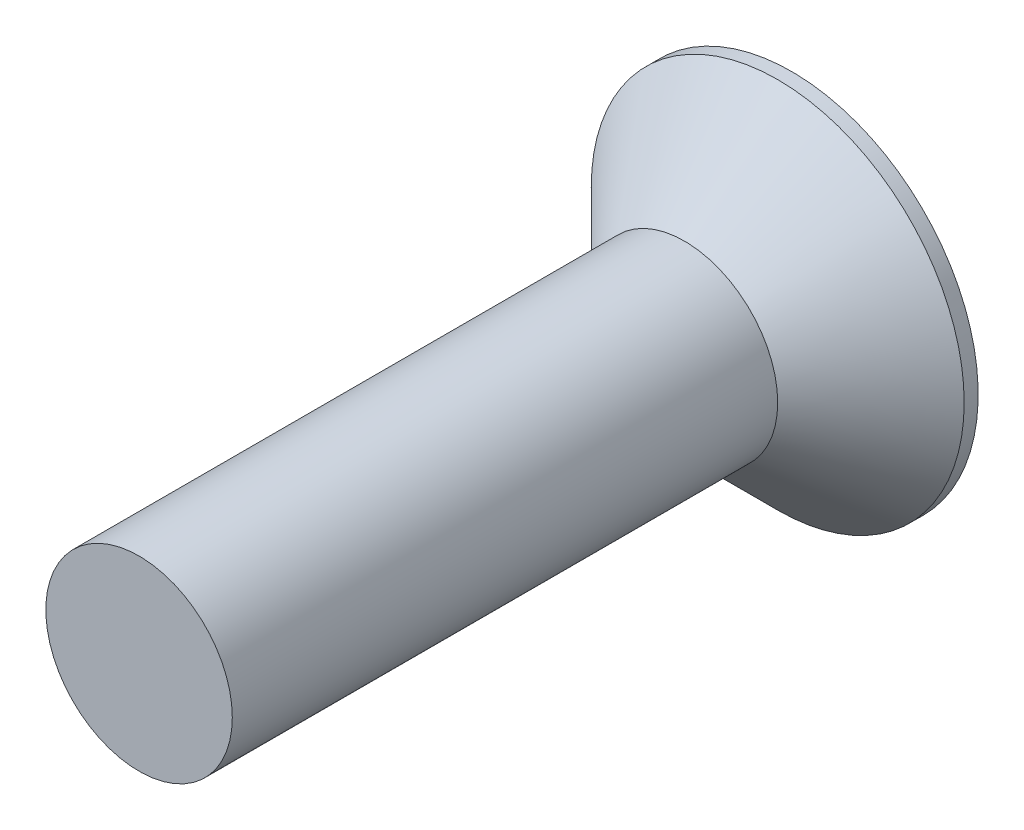
from build123d import *

# Parameters (mm, degrees)
SKETCH1_R          = 2
EXTRUDE1_DEPTH     = 14
SKETCH6_R          = 4
EXTRUDE2_DEPTH     = 2.3
CUT_EXTRUDE1_DEPTH = 1.875


with BuildPart() as part:
    # Sketch1 → Extrude1 (new body)
    with BuildSketch(Plane.XY):
        Circle(SKETCH1_R)
    extrude(amount=-EXTRUDE1_DEPTH)

    # Sketch6 → Extrude2 (add)
    with BuildSketch(Plane(origin=(0, 0, -14), x_dir=(-1, 0, 0), z_dir=(0, 0, -1))):
        Circle(SKETCH6_R)
    extrude(amount=-EXTRUDE2_DEPTH)

    # Sketch10 → Cut-Revolve2 (revolve, cut)
    with BuildSketch(Plane(origin=(0, 0, 0), x_dir=(0, 0, -1), z_dir=(1, 0, 0)), mode=Mode.PRIVATE) as cut_revolve2_sk:
        Polygon((13.7, -4), (11.7, -2), (11.7, -4), align=None)
    revolve(cut_revolve2_sk.sketch.rotate(Axis((0, 0, 0), (0, 0, -1)), 90), axis=Axis((0, 0, 0), (0, 0, -1)), mode=Mode.SUBTRACT)

    # Sketch7 → Cut-Extrude1 (cut)
    with BuildSketch(Plane.XY.offset(-14)):
        Polygon((0, 1.443375673), (-1.25, 0.721687836), (-1.25, -0.721687836), (0, -1.443375673), (1.25, -0.721687836), (1.25, 0.721687836), align=None)
    extrude(amount=CUT_EXTRUDE1_DEPTH, mode=Mode.SUBTRACT)


solid = part.part
